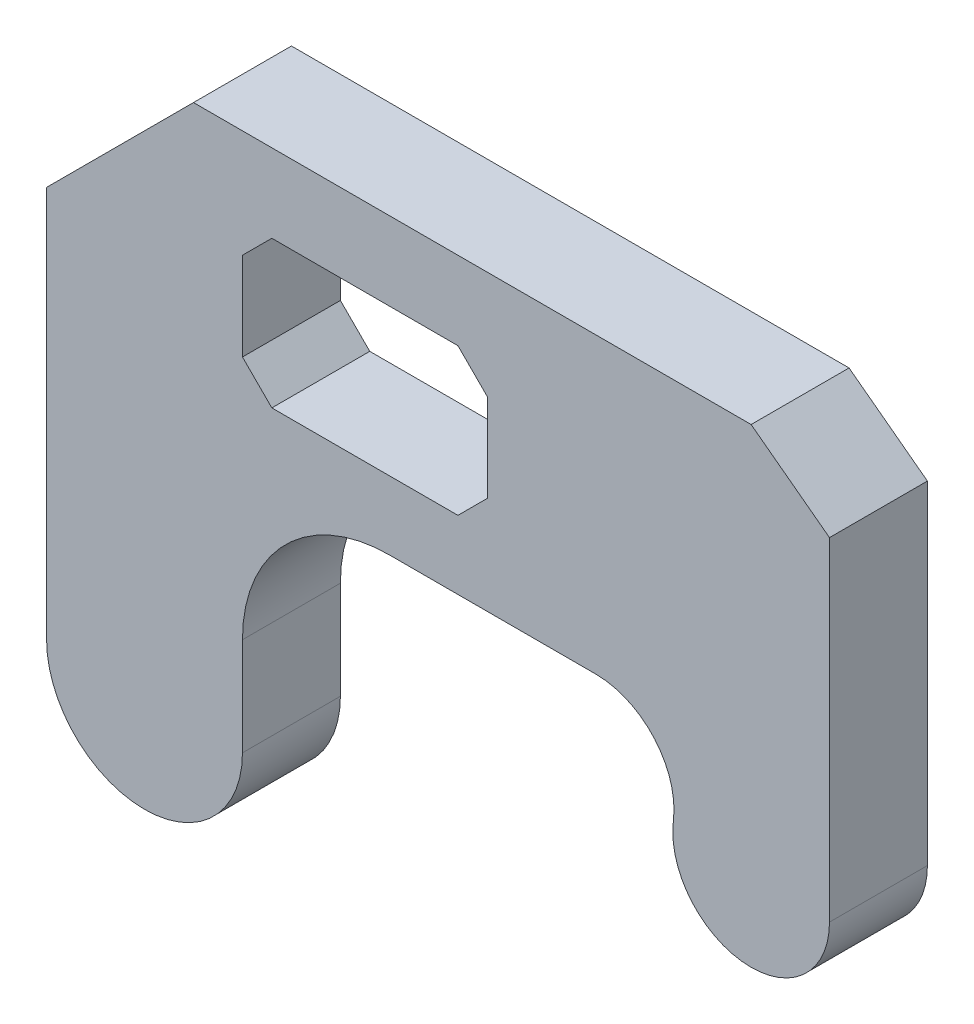
from build123d import *

# Parameters (mm, degrees)
SALIENTE_EXTRUIR1_DEPTH = 10


with BuildPart() as part:
    # Croquis1 → Saliente-Extruir1 (new body)
    with BuildSketch(Plane.XY):
        with BuildLine():
            Line((0, 0), (0, 40))
            Line((0, 40), (15, 55))
            Line((15, 55), (71.937253933, 55))
            Line((71.937253933, 55), (79.937253933, 49))
            Line((79.937253933, 49), (79.937253933, 15))
            ThreePointArc((79.937253933, 15), (71.436270633, 7.015701926), (64, 16))
            ThreePointArc((64, 16), (62.062746067, 22.291502622), (56.062746067, 25))
            Line((56.062746067, 25), (35, 25))
            ThreePointArc((35, 25), (24.393398282, 20.606601718), (20, 10))
            Line((20, 10), (20, 0))
            ThreePointArc((20, 0), (10, -10), (0, 0))
        make_face()
        Polygon((20, 44), (23, 47), (42, 47), (45, 44), (45, 35), (42, 32), (23, 32), (20, 35), align=None, mode=Mode.SUBTRACT)
    extrude(amount=SALIENTE_EXTRUIR1_DEPTH)


solid = part.part
